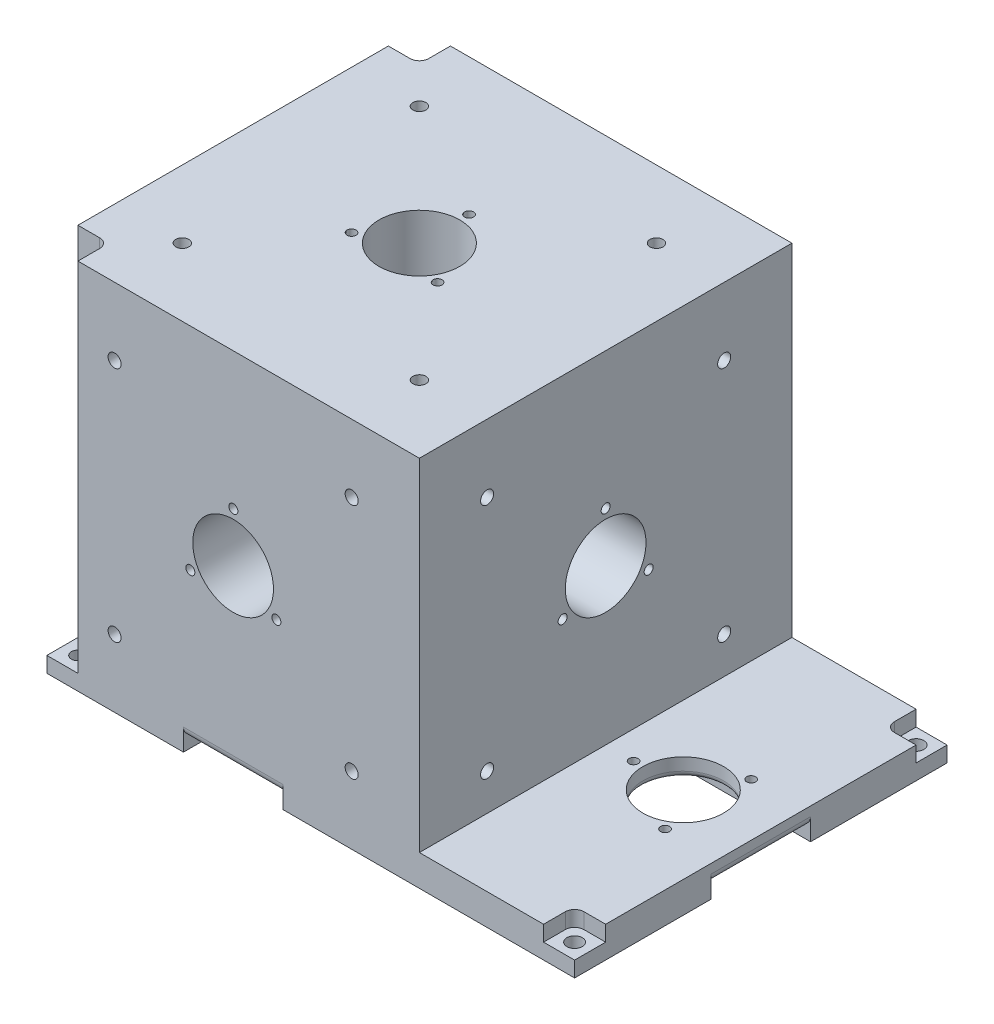
from build123d import *

# Parameters (mm, degrees)
BOSS_EXTRUDE1_DEPTH     = 120
SKETCH3_W               = 120
SKETCH3_H               = 10
BOSS_EXTRUDE2_DEPTH     = 50
SKETCH11_R              = 13
CUT_EXTRUDE3_DEPTH      = 120
CUT_EXTRUDE12_DEPTH     = 4
SKETCH10_R              = 13
CUT_EXTRUDE13_DEPTH     = 116
SKETCH13_R              = 13
CUT_EXTRUDE17_DEPTH     = 120
SKETCH17_R              = 13
CUT_EXTRUDE18_DEPTH     = 6
FILLET1_R               = 3
FILLET2_R               = 3
SKETCH19_W              = 10
SKETCH19_H              = 10
CUT_EXTRUDE20_DEPTH     = 115
FILLET3_R               = 3
SKETCH21_W              = 10
SKETCH21_H              = 10
CUT_EXTRUDE22_DEPTH     = 5
FILLET4_R               = 3
M3_5_TAPPED_HOLE1_D     = 2.9
M3_5_TAPPED_HOLE1_DEPTH = 5
M3_5_TAPPED_HOLE1_TIP   = 0.871247898
M5_TAPPED_HOLE1_D       = 4.2
M5_TAPPED_HOLE1_DEPTH   = 4.5
M5_TAPPED_HOLE1_TIP     = 1.2618073
M5_TAPPED_HOLE2_D       = 4.2
M5_TAPPED_HOLE2_DEPTH   = 4.5
M5_TAPPED_HOLE2_TIP     = 1.2618073
FILLET5_R               = 3
M5_TAPPED_HOLE3_D       = 4.2
M5_TAPPED_HOLE3_DEPTH   = 4.5
M5_TAPPED_HOLE3_TIP     = 1.2618073
M3_5_TAPPED_HOLE2_D     = 2.9
M3_5_TAPPED_HOLE2_DEPTH = 5
M3_5_TAPPED_HOLE2_TIP   = 0.871247898
M3_5_TAPPED_HOLE3_D     = 2.9
M3_5_TAPPED_HOLE3_DEPTH = 5
M3_5_TAPPED_HOLE3_TIP   = 0.871247898
M5_TAPPED_HOLE4_D       = 4.2
M5_TAPPED_HOLE4_DEPTH   = 4.5
M5_TAPPED_HOLE4_TIP     = 1.2618073
M3_5_TAPPED_HOLE5_D     = 2.9
M3_5_TAPPED_HOLE5_DEPTH = 5
M3_5_TAPPED_HOLE5_TIP   = 0.871247898
M3_5_TAPPED_HOLE6_D     = 2.9
M3_5_TAPPED_HOLE6_DEPTH = 5
M3_5_TAPPED_HOLE6_TIP   = 0.871247898
M5_TAPPED_HOLE5_D       = 4.2
M5_TAPPED_HOLE5_DEPTH   = 4.5
M5_TAPPED_HOLE5_TIP     = 1.2618073
M3_5_TAPPED_HOLE7_D     = 2.9
M3_5_TAPPED_HOLE7_DEPTH = 5
M3_5_TAPPED_HOLE7_TIP   = 0.871247898
M6_TAPPED_HOLE1_D       = 5
M5_TAPPED_HOLE7_D       = 4.2
FILLET6_R               = 2


with BuildPart() as part:
    # Sketch1 → Boss-Extrude1 (new body)
    with BuildSketch(Plane(origin=(0, 0, 0), x_dir=(1, 0, 0), z_dir=(0, 1, 0))):
        Polygon((-60, 60), (-60, -60), (60, -60), (60, 60), (0, 60), align=None)
    extrude(amount=BOSS_EXTRUDE1_DEPTH)

    # Sketch3 → Boss-Extrude2 (add)
    with BuildSketch(Plane(origin=(60, 0, 0), x_dir=(0, 0, -1), z_dir=(1, 0, 0))):
        with Locations((0, 5)):
            Rectangle(SKETCH3_W, SKETCH3_H)
    extrude(amount=BOSS_EXTRUDE2_DEPTH)

    # Sketch11 → Cut-Extrude3 (cut)
    with BuildSketch(Plane.XY.offset(60)):
        with Locations((0, 60)):
            Circle(SKETCH11_R)
    extrude(amount=-CUT_EXTRUDE3_DEPTH, mode=Mode.SUBTRACT)

    # Sketch4 → Cut-Extrude12 (cut)
    with BuildSketch(Plane.XZ):
        Polygon((16, 16), (110, 16), (110, -16), (16, -16), (16, -60), (-16, -60), (-16, -16), (-60, -16), (-60, 16), (-16, 16), (-16, 60), (16, 60), align=None)
    extrude(amount=-CUT_EXTRUDE12_DEPTH, mode=Mode.SUBTRACT)

    # Sketch10 → Cut-Extrude13 (cut)
    with BuildSketch(Plane(origin=(0, 120, 0), x_dir=(1, 0, 0), z_dir=(0, 1, 0))):
        with Locations(Location((0, 0, 0), (0, 0, 270))):
            Circle(SKETCH10_R)
    extrude(amount=-CUT_EXTRUDE13_DEPTH, mode=Mode.SUBTRACT)

    # Sketch13 → Cut-Extrude17 (cut)
    with BuildSketch(Plane(origin=(60, 0, 0), x_dir=(0, 0, -1), z_dir=(1, 0, 0))):
        with Locations((0, 60)):
            Circle(SKETCH13_R)
    extrude(amount=-CUT_EXTRUDE17_DEPTH, mode=Mode.SUBTRACT)

    # Sketch17 → Cut-Extrude18 (cut)
    with BuildSketch(Plane(origin=(0, 10, 0), x_dir=(1, 0, 0), z_dir=(0, 1, 0))):
        with Locations(Location((85, 0, 0), (0, 0, 270))):
            Circle(SKETCH17_R)
    extrude(amount=-CUT_EXTRUDE18_DEPTH, mode=Mode.SUBTRACT)

    # Fillet1
    fillet1_edges = [part.edges().sort_by_distance(p)[0] for p in [
        (16, 2, -16),
        (-16, 2, -16),
        (-16, 2, 16),
        (16, 2, 16),
    ]]
    fillet(fillet1_edges, radius=FILLET1_R)

    # Fillet2
    fillet2_edges = [part.edges().sort_by_distance(p)[0] for p in [
        (0, 4, -13),
    ]]
    fillet(fillet2_edges, radius=FILLET2_R)

    # Sketch19 → Cut-Extrude20 (cut)
    with BuildSketch(Plane(origin=(0, 120, 0), x_dir=(1, 0, 0), z_dir=(0, 1, 0))):
        with Locations((-55, 55)):
            Rectangle(SKETCH19_W, SKETCH19_H)
        with Locations((-55, -55)):
            Rectangle(SKETCH19_W, SKETCH19_H)
    extrude(amount=-CUT_EXTRUDE20_DEPTH, mode=Mode.SUBTRACT)

    # Fillet3
    fillet3_edges = [part.edges().sort_by_distance(p)[0] for p in [
        (-50, 62.5, -50),
        (-50, 62.5, 50),
    ]]
    fillet(fillet3_edges, radius=FILLET3_R)

    # Sketch21 → Cut-Extrude22 (cut)
    with BuildSketch(Plane(origin=(0, 10, 0), x_dir=(1, 0, 0), z_dir=(0, 1, 0))):
        with Locations((105, -55)):
            Rectangle(SKETCH21_W, SKETCH21_H)
        with Locations((105, 55)):
            Rectangle(SKETCH21_W, SKETCH21_H)
    extrude(amount=-CUT_EXTRUDE22_DEPTH, mode=Mode.SUBTRACT)

    # Fillet4
    fillet4_edges = [part.edges().sort_by_distance(p)[0] for p in [
        (100, 7.5, 50),
        (100, 7.5, -50),
    ]]
    fillet(fillet4_edges, radius=FILLET4_R)

    # M3.5 Tapped Hole1
    with Locations(Plane.ZY.offset(60)):
        with Locations((0, 76), (-13.856406461, 52), (13.856406461, 52)):
            Hole(M3_5_TAPPED_HOLE1_D / 2, depth=M3_5_TAPPED_HOLE1_DEPTH)
            with Locations((0, 0, -(M3_5_TAPPED_HOLE1_DEPTH + M3_5_TAPPED_HOLE1_TIP / 2))):  # 118° drill point
                Cone(0, M3_5_TAPPED_HOLE1_D / 2, M3_5_TAPPED_HOLE1_TIP, mode=Mode.SUBTRACT)

    # M5 Tapped Hole1
    with Locations(Plane(origin=(60, 0, 0), x_dir=(0, 0, -1), z_dir=(1, 0, 0))):
        with Locations((-38.183766184, 21.816233816), (38.183766184, 21.816233816), (38.183766184, 98.183766184), (-38.183766184, 98.183766184)):
            Hole(M5_TAPPED_HOLE1_D / 2, depth=M5_TAPPED_HOLE1_DEPTH)
            with Locations((0, 0, -(M5_TAPPED_HOLE1_DEPTH + M5_TAPPED_HOLE1_TIP / 2))):  # 118° drill point
                Cone(0, M5_TAPPED_HOLE1_D / 2, M5_TAPPED_HOLE1_TIP, mode=Mode.SUBTRACT)

    # M5 Tapped Hole2
    with Locations(Plane.ZY.offset(60)):
        with Locations((-38.183766184, 98.183766184), (38.183766184, 98.183766184), (-38.183766184, 21.816233816), (38.183766184, 21.816233816)):
            Hole(M5_TAPPED_HOLE2_D / 2, depth=M5_TAPPED_HOLE2_DEPTH)
            with Locations((0, 0, -(M5_TAPPED_HOLE2_DEPTH + M5_TAPPED_HOLE2_TIP / 2))):  # 118° drill point
                Cone(0, M5_TAPPED_HOLE2_D / 2, M5_TAPPED_HOLE2_TIP, mode=Mode.SUBTRACT)

    # Fillet5
    fillet5_edges = [part.edges().sort_by_distance(p)[0] for p in [
        (0, 4, 60),
        (110, 4, 0),
        (0, 4, -60),
        (-60, 4, 0),
    ]]
    fillet(fillet5_edges, radius=FILLET5_R)

    # M5 Tapped Hole3
    with Locations(Plane(origin=(0, 0, -60), x_dir=(-1, 0, 0), z_dir=(0, 0, -1))):
        with Locations((-38.183766184, 98.183766184), (38.183766184, 98.183766184), (38.183766184, 21.816233816), (-38.183766184, 21.816233816)):
            Hole(M5_TAPPED_HOLE3_D / 2, depth=M5_TAPPED_HOLE3_DEPTH)
            with Locations((0, 0, -(M5_TAPPED_HOLE3_DEPTH + M5_TAPPED_HOLE3_TIP / 2))):  # 118° drill point
                Cone(0, M5_TAPPED_HOLE3_D / 2, M5_TAPPED_HOLE3_TIP, mode=Mode.SUBTRACT)

    # M3.5 Tapped Hole2
    with Locations(Plane(origin=(0, 0, -60), x_dir=(-1, 0, 0), z_dir=(0, 0, -1))):
        with Locations((-13.856406461, 52), (0, 76), (13.856406461, 52)):
            Hole(M3_5_TAPPED_HOLE2_D / 2, depth=M3_5_TAPPED_HOLE2_DEPTH)
            with Locations((0, 0, -(M3_5_TAPPED_HOLE2_DEPTH + M3_5_TAPPED_HOLE2_TIP / 2))):  # 118° drill point
                Cone(0, M3_5_TAPPED_HOLE2_D / 2, M3_5_TAPPED_HOLE2_TIP, mode=Mode.SUBTRACT)

    # M3.5 Tapped Hole3
    with Locations(Plane(origin=(0, 120, 0), x_dir=(1, 0, 0), z_dir=(0, 1, 0))):
        with Locations((0, 16), (13.856406461, -8), (-13.856406461, -8)):
            Hole(M3_5_TAPPED_HOLE3_D / 2, depth=M3_5_TAPPED_HOLE3_DEPTH)
            with Locations((0, 0, -(M3_5_TAPPED_HOLE3_DEPTH + M3_5_TAPPED_HOLE3_TIP / 2))):  # 118° drill point
                Cone(0, M3_5_TAPPED_HOLE3_D / 2, M3_5_TAPPED_HOLE3_TIP, mode=Mode.SUBTRACT)

    # M5 Tapped Hole4
    with Locations(Plane(origin=(0, 120, 0), x_dir=(1, 0, 0), z_dir=(0, 1, 0))):
        with Locations((38.183766184, 38.183766184), (38.183766184, -38.183766184), (-38.183766184, -38.183766184), (-38.183766184, 38.183766184)):
            Hole(M5_TAPPED_HOLE4_D / 2, depth=M5_TAPPED_HOLE4_DEPTH)
            with Locations((0, 0, -(M5_TAPPED_HOLE4_DEPTH + M5_TAPPED_HOLE4_TIP / 2))):  # 118° drill point
                Cone(0, M5_TAPPED_HOLE4_D / 2, M5_TAPPED_HOLE4_TIP, mode=Mode.SUBTRACT)

    # M3.5 Tapped Hole5
    with Locations(Plane(origin=(60, 0, 0), x_dir=(0, 0, -1), z_dir=(1, 0, 0))):
        with Locations((-13.856406461, 52), (13.856406461, 52), (0, 76)):
            Hole(M3_5_TAPPED_HOLE5_D / 2, depth=M3_5_TAPPED_HOLE5_DEPTH)
            with Locations((0, 0, -(M3_5_TAPPED_HOLE5_DEPTH + M3_5_TAPPED_HOLE5_TIP / 2))):  # 118° drill point
                Cone(0, M3_5_TAPPED_HOLE5_D / 2, M3_5_TAPPED_HOLE5_TIP, mode=Mode.SUBTRACT)

    # M3.5 Tapped Hole6
    with Locations(Plane.XY.offset(60)):
        with Locations((0.077859326, 75.922140674), (13.934265787, 51.922140674), (-13.778547134, 51.922140674)):
            Hole(M3_5_TAPPED_HOLE6_D / 2, depth=M3_5_TAPPED_HOLE6_DEPTH)
            with Locations((0, 0, -(M3_5_TAPPED_HOLE6_DEPTH + M3_5_TAPPED_HOLE6_TIP / 2))):  # 118° drill point
                Cone(0, M3_5_TAPPED_HOLE6_D / 2, M3_5_TAPPED_HOLE6_TIP, mode=Mode.SUBTRACT)

    # M5 Tapped Hole5
    with Locations(Plane.XY.offset(60)):
        with Locations((-38.183766184, 98.183766184), (38.183766184, 98.183766184), (38.183766184, 21.816233816), (-38.183766184, 21.816233816)):
            Hole(M5_TAPPED_HOLE5_D / 2, depth=M5_TAPPED_HOLE5_DEPTH)
            with Locations((0, 0, -(M5_TAPPED_HOLE5_DEPTH + M5_TAPPED_HOLE5_TIP / 2))):  # 118° drill point
                Cone(0, M5_TAPPED_HOLE5_D / 2, M5_TAPPED_HOLE5_TIP, mode=Mode.SUBTRACT)

    # M3.5 Tapped Hole7
    with Locations(Plane(origin=(0, 10, 0), x_dir=(1, 0, 0), z_dir=(0, 1, 0))):
        with Locations((93, -13.856406461), (69, 0), (93, 13.856406461)):
            Hole(M3_5_TAPPED_HOLE7_D / 2, depth=M3_5_TAPPED_HOLE7_DEPTH)
            with Locations((0, 0, -(M3_5_TAPPED_HOLE7_DEPTH + M3_5_TAPPED_HOLE7_TIP / 2))):  # 118° drill point
                Cone(0, M3_5_TAPPED_HOLE7_D / 2, M3_5_TAPPED_HOLE7_TIP, mode=Mode.SUBTRACT)

    # M6 Tapped Hole1 (through all)
    with Locations(Plane(origin=(0, 5, 0), x_dir=(1, 0, 0), z_dir=(0, 1, 0))):
        with Locations((105, -55), (105, 55)):
            Hole(M6_TAPPED_HOLE1_D / 2)

    # M5 Tapped Hole7 (through all)
    with Locations(Plane(origin=(0, 5, 0), x_dir=(1, 0, 0), z_dir=(0, 1, 0))):
        with Locations((-55, 55), (-55, -55)):
            Hole(M5_TAPPED_HOLE7_D / 2)

    # Fillet6
    fillet6_edges = [part.edges().sort_by_distance(p)[0] for p in [
        (85, 4, -13),
    ]]
    fillet(fillet6_edges, radius=FILLET6_R)


solid = part.part
